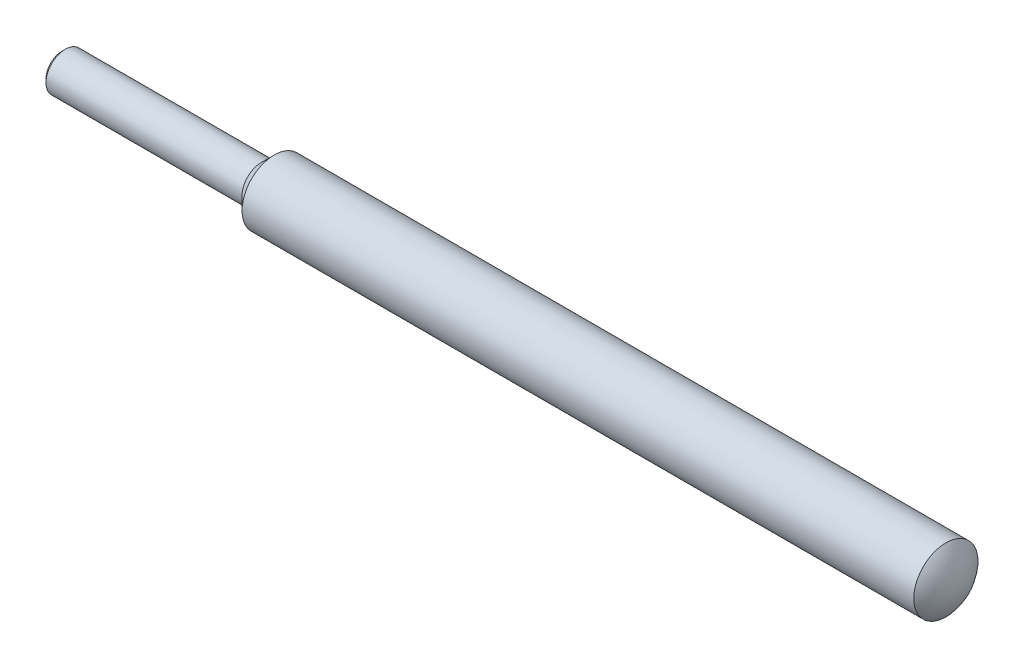
from build123d import *

# Parameters (mm, degrees)
CHAMFER1_SIZE = 1


with BuildPart() as part:
    # Sketch2 → Revolve1 (revolve)
    with BuildSketch(Plane.XY, mode=Mode.PRIVATE) as revolve1_sk:
        with BuildLine():
            Line((0, 0), (275, 0))
            Line((275, 0), (278.819660113, 0))
            ThreePointArc((278.819660113, 0), (277.832245497, 5.352331347), (275, 10))
            Line((275, 10), (66, 10))
            Line((66, 10), (62, 6))
            Line((62, 6), (0, 6))
            Line((0, 6), (0, 0))
        make_face()
    revolve(revolve1_sk.sketch.rotate(Axis((0, 0, 0), (1, 0, 0)), 90), axis=Axis((0, 0, 0), (1, 0, 0)))

    # Chamfer1
    chamfer1_edges = [part.edges().sort_by_distance(p)[0] for p in [
        (0, 0, -6),
    ]]
    chamfer(chamfer1_edges, length=CHAMFER1_SIZE)


solid = part.part
